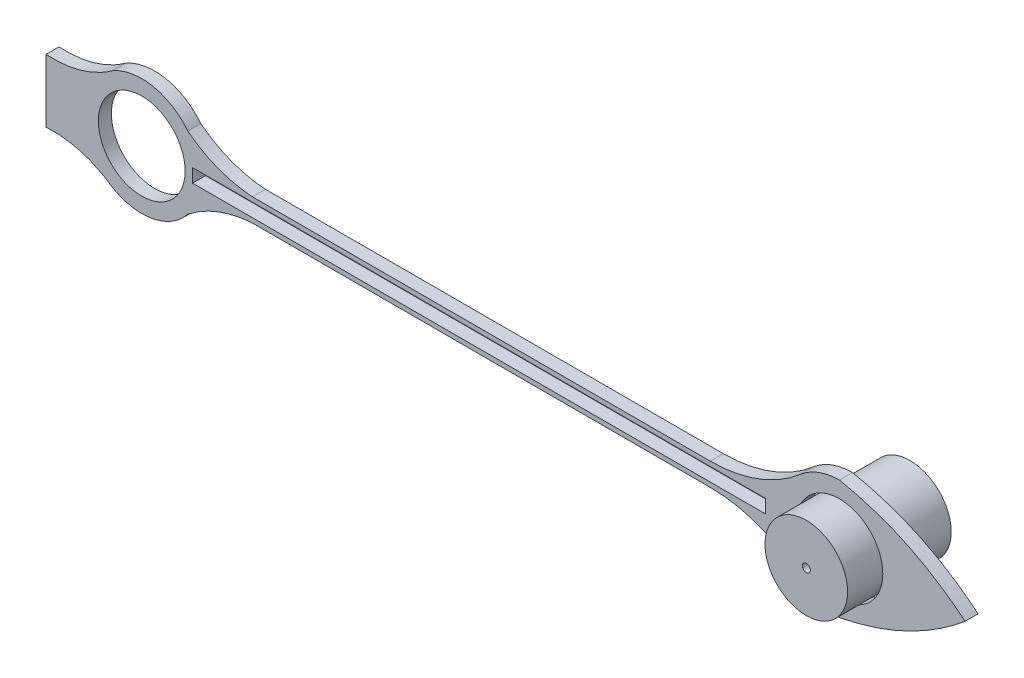
from build123d import *

# Parameters (mm, degrees)
ESQUISSE1_R             = 0.6
BOSS_EXTRU_1_DEPTH      = 0.18
ESQUISSE2_W             = 7.925210263
ESQUISSE2_H             = 0.186225418
ENL_V_MAT_EXTRU_1_DEPTH = 0.18
BOSS_EXTRU_2_DEPTH      = 0.458
BOSS_EXTRU_2_DEPTH_BACK = 0.195
ESQUISSE3_R             = 0.571329139
ESQUISSE3_R_2           = 0.055500224
ESQUISSE4_R             = 0.571329139
ESQUISSE4_R_2           = 0.082184666
BOSS_EXTRU_3_DEPTH      = 0.78


with BuildPart() as part:
    # Esquisse1 → Boss.-Extru.1 (new body)
    with BuildSketch(Plane.XY):
        with BuildLine():
            Line((2.223699387, 0), (8.555848237, 0))
            ThreePointArc((8.555848237, 0), (9.220464403, 0.120032205), (9.801106522, 0.464962786))
            ThreePointArc((9.801106522, 0.464962786), (10.052940049, 0.61456455), (10.341194426, 0.666624385))
            add(Edge.make_bspline(
                [(10.341194426, 0.666624385), (11.330037109, 0.471790516), (12.077784431, -0.157435194)],
                knots=[0, 0, 0, 1, 1, 1], degree=2))
            add(Edge.make_bspline(
                [(10.341194426, -0.981494774), (11.330037109, -0.786660904), (12.077784431, -0.157435194)],
                knots=[0, 0, 0, 1, 1, 1], degree=2))
            ThreePointArc((10.341194426, -0.981494774), (10.052940049, -0.929434938), (9.801106522, -0.779833175))
            ThreePointArc((9.801106522, -0.779833175), (9.220464403, -0.434902593), (8.555848237, -0.314870389))
            Line((8.555848237, -0.314870389), (2.223699387, -0.314870389))
            add(Edge.make_bspline(
                [(1.330849564, -0.654046001), (1.721823908, -0.349562315), (2.223699387, -0.314870389)],
                knots=[0, 0, 0, 1, 1, 1], degree=2))
            ThreePointArc((1.330849564, -0.654046001), (0.85005841, -0.950565912), (0.292489664, -0.860004965))
            add(Edge.make_bspline(
                [(-0.631189968, -0.593117735), (-0.120424132, -0.564042379), (0.292489664, -0.860004965)],
                knots=[0, 0, 0, 1, 1, 1], degree=2))
            Line((-0.631189968, -0.593117735), (-0.631189968, 0.278247347))
            add(Edge.make_bspline(
                [(-0.631189968, 0.278247347), (-0.120424132, 0.24917199), (0.292489664, 0.545134577)],
                knots=[0, 0, 0, 1, 1, 1], degree=2))
            ThreePointArc((0.292489664, 0.545134577), (0.85005841, 0.635695523), (1.330849564, 0.339175613))
            add(Edge.make_bspline(
                [(1.330849564, 0.339175613), (1.721823908, 0.034691927), (2.223699387, 0)],
                knots=[0, 0, 0, 1, 1, 1], degree=2))
        make_face()
        with Locations((10.341194426, -0.157435194)):
            Circle(ESQUISSE1_R, mode=Mode.SUBTRACT)
        with Locations((0.69274072, -0.157435194)):
            Circle(ESQUISSE1_R, mode=Mode.SUBTRACT)
    extrude(amount=BOSS_EXTRU_1_DEPTH)

    # Esquisse2 → Enlèv. mat.-Extru.1 (cut)
    with BuildSketch(Plane.XY.offset(0.18)):
        with Locations((5.358097221, -0.157435194)):
            Rectangle(ESQUISSE2_W, ESQUISSE2_H)
    extrude(amount=-ENL_V_MAT_EXTRU_1_DEPTH, mode=Mode.SUBTRACT)


with BuildPart() as body_2:
    # Esquisse3 → Boss.-Extru.2 (new, two sides: drawn at the far end of the back side and taken through both)
    with BuildSketch(Plane.XY.offset(0.18).offset(-BOSS_EXTRU_2_DEPTH_BACK)):
        with Locations((10.341194426, -0.157435194)):
            Circle(ESQUISSE3_R)
        with Locations((10.341194426, -0.157435194)):
            Circle(ESQUISSE3_R_2, mode=Mode.SUBTRACT)
    extrude(amount=BOSS_EXTRU_2_DEPTH + BOSS_EXTRU_2_DEPTH_BACK)

    # Esquisse4 → Boss.-Extru.3 (add)
    with BuildSketch(Plane(origin=(0, 0, -0.015), x_dir=(-1, 0, 0), z_dir=(0, 0, -1))):
        with Locations(Location((-10.341194426, -0.157435194, 0), (0, 0, 180))):
            Circle(ESQUISSE4_R)
        with Locations((-10.341194426, -0.157435194)):
            Circle(ESQUISSE4_R_2, mode=Mode.SUBTRACT)
    extrude(amount=BOSS_EXTRU_3_DEPTH)


solid = Compound([part.part, body_2.part])
